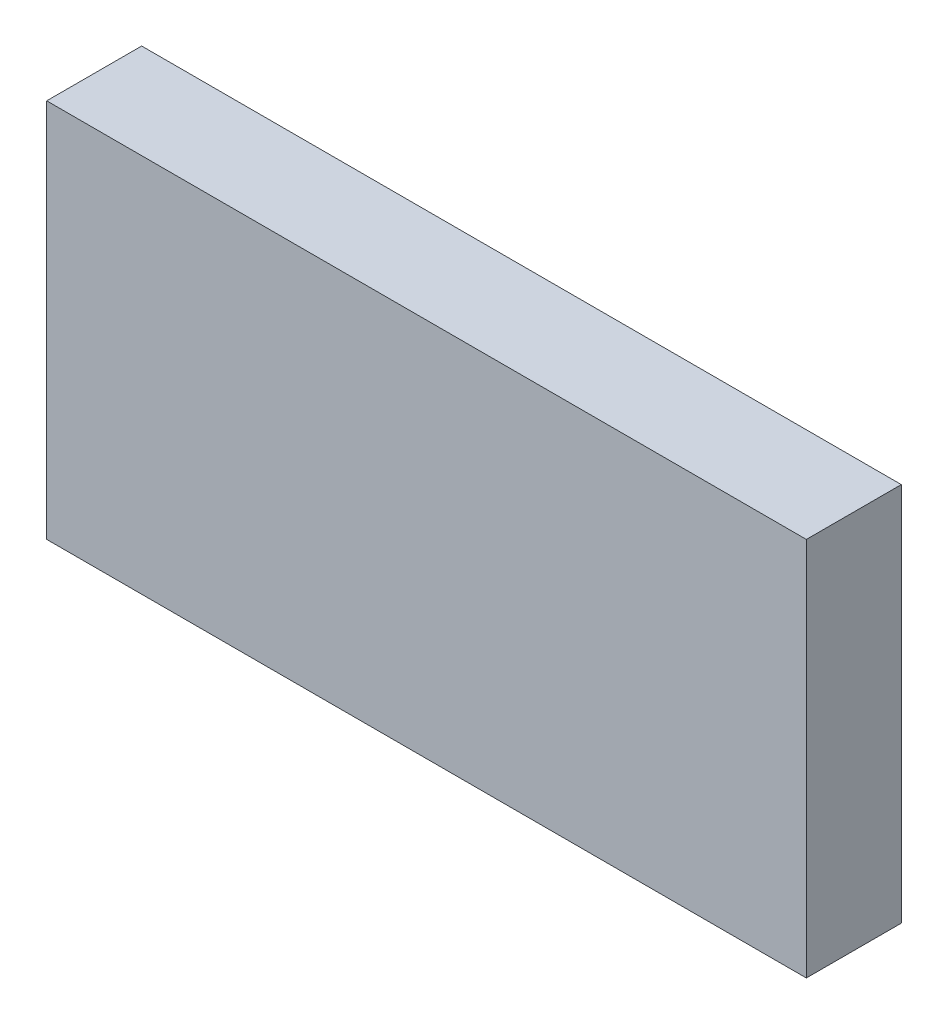
from build123d import *

# Parameters (mm, degrees)
SKETCH1_W           = 24
SKETCH1_H           = 12
BOSS_EXTRUDE1_DEPTH = 3


with BuildPart() as part:
    # Sketch1 → Boss-Extrude1 (new body)
    with BuildSketch(Plane.XY):
        with Locations((62.585871194, -190)):
            Rectangle(SKETCH1_W, SKETCH1_H)
    extrude(amount=BOSS_EXTRUDE1_DEPTH)


solid = part.part
